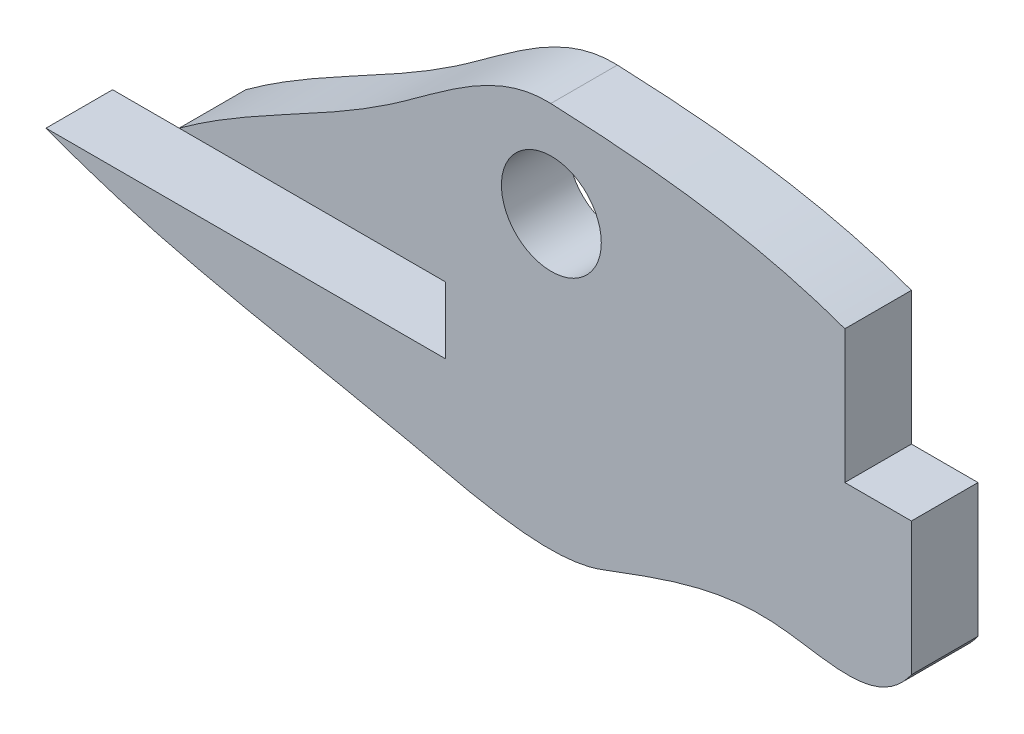
from build123d import *

# Parameters (mm, degrees)
SKETCH1_R           = 2.38125
BOSS_EXTRUDE1_DEPTH = 3.175
BOSS_EXTRUDE2_DEPTH = 3.175


with BuildPart() as part:
    # Sketch1 → Boss-Extrude1 (new body)
    with BuildSketch(Plane.XY):
        with BuildLine():
            Line((-19.05, 0), (0, 0))
            Line((0, 0), (0, 3.175))
            Line((0, 3.175), (-12.7, 3.175))
            add(Edge.make_bspline(
                [(-19.05, 0), (-13.112033971, -2.27730223), (-5.155795632, -3.204594962), (8.217288269, -6.774378233), (12.030948412, 0.931903495), (12.931224231, 8.259301282), (4.816413804, 15.369954974), (-3.592277072, 7.785567441), (-9.215384474, 5.719027598), (-12.7, 3.175)],
                knots=[0, 0, 0, 0, 0.256909303, 0.405237787, 0.477393103, 0.59131784, 0.708774719, 0.830232282, 1, 1, 1, 1], degree=3))
        make_face()
        with Locations((5.048367475, 8.51005191)):
            Circle(SKETCH1_R, mode=Mode.SUBTRACT)
    extrude(amount=BOSS_EXTRUDE1_DEPTH)

    # Sketch2 → Boss-Extrude2 (add)
    with BuildSketch(Plane.XY.offset(3.175)):
        with BuildLine():
            add(Edge.make_bspline(
                [(4.988150959, 13.056659727), (9.718743656, 12.859855216), (14.559374774, 12.389270948), (19.04312554, 10.761627981)],
                knots=[0, 0, 0, 0, 1, 1, 1, 1], degree=3))
            Line((4.988150959, 13.056659727), (8.479749464, 10.133745789))
            Line((8.479749464, 10.133745789), (7.569273367, -4.93526217))
            add(Edge.make_bspline(
                [(7.569273367, -4.93526217), (10.177388397, -3.973098163), (15.151025201, -1.968746735), (20.532585299, -4.307476576), (22.21812554, -1.938372019)],
                knots=[0, 0, 0, 0, 0.552836204, 1, 1, 1, 1], degree=3))
            Line((22.21812554, -1.938372019), (9.51812554, -1.938372019))
            Line((9.51812554, -1.938372019), (9.51812554, 10.761627981))
            Line((9.51812554, 10.761627981), (19.04312554, 10.761627981))
        make_face()
        Polygon((19.04312554, 4.411627981), (19.04312554, 10.761627981), (9.51812554, 10.761627981), (9.51812554, -1.938372019), (22.21812554, -1.938372019), (22.21812554, 4.411627981), align=None)
    extrude(amount=-BOSS_EXTRUDE2_DEPTH)


solid = part.part
